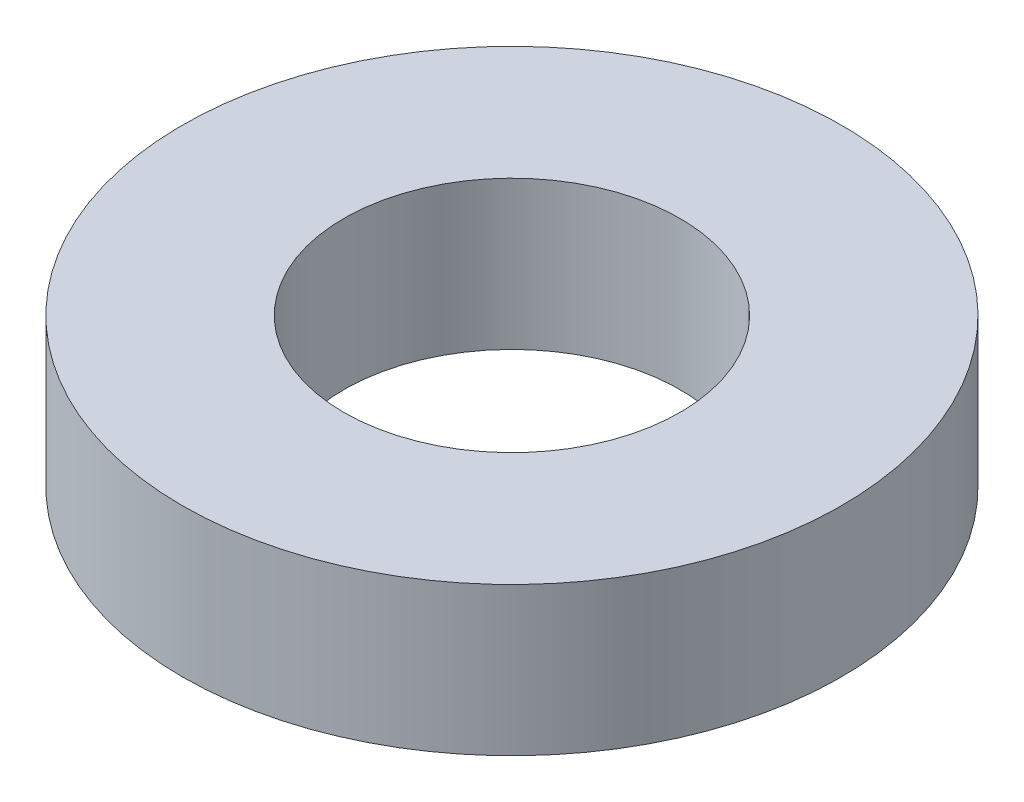
from build123d import *

# Parameters (mm, degrees)
SKETCH_1_R      = 5
SKETCH_1_R_2    = 2.55
EXTRUDE_1_DEPTH = 2.25


with BuildPart() as part:
    # 草图1 → 凸台-拉伸1 (new body)
    with BuildSketch(Plane(origin=(0, 0, 0), x_dir=(1, 0, 0), z_dir=(0, 1, 0))):
        with Locations(Location((0, 0, 0), (0, 0, 270))):
            Circle(SKETCH_1_R)
        with Locations(Location((0, 0, 0), (0, 0, 270))):
            Circle(SKETCH_1_R_2, mode=Mode.SUBTRACT)
    extrude(amount=EXTRUDE_1_DEPTH)


solid = part.part
